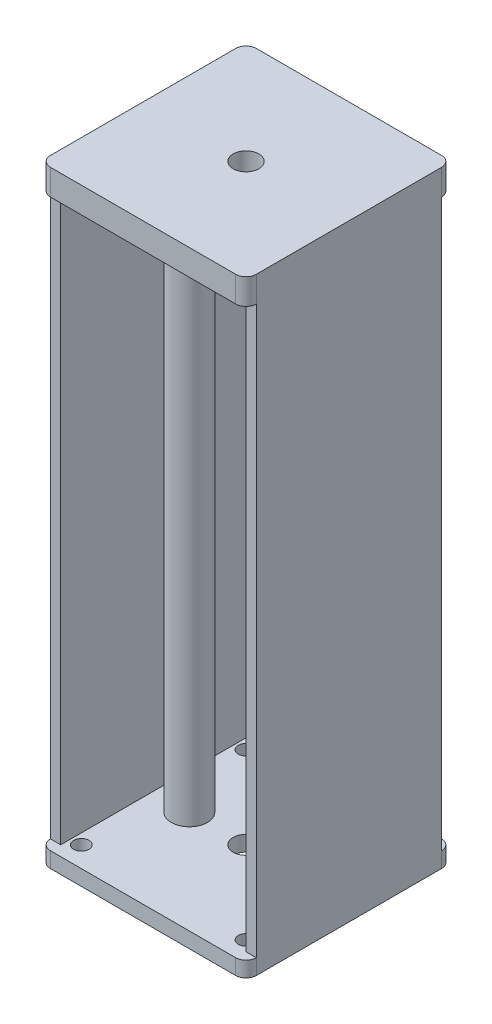
from build123d import *

# Parameters (mm, degrees)
SKETCH1_W           = 40
SKETCH1_H           = 40
BOSS_EXTRUDE1_DEPTH = 5
FILLET1_R           = 2
SKETCH2_W           = 2
SKETCH2_H           = 36
BOSS_EXTRUDE2_DEPTH = 110
SKETCH3_W           = 40
SKETCH3_H           = 40
BOSS_EXTRUDE3_DEPTH = 3
FILLET2_R           = 2
SKETCH4_R           = 1.5
CUT_EXTRUDE1_DEPTH  = 10
SKETCH5_R           = 2.5
CUT_EXTRUDE2_DEPTH  = 127.368508888
SKETCH6_R           = 2.5
CUT_EXTRUDE4_DEPTH  = 131.858702575
SKETCH8_R           = 3.5
BOSS_EXTRUDE4_DEPTH = 114


with BuildPart() as part:
    # Sketch1 → Boss-Extrude1 (new body)
    with BuildSketch(Plane(origin=(0, 0, 0), x_dir=(1, 0, 0), z_dir=(0, 1, 0))):
        with Locations((20, -20)):
            Rectangle(SKETCH1_W, SKETCH1_H)
    extrude(amount=BOSS_EXTRUDE1_DEPTH)

    # Fillet1
    fillet1_edges = [part.edges().sort_by_distance(p)[0] for p in [
        (40, 2.5, 0),
        (40, 2.5, 40),
        (0, 2.5, 40),
        (0, 2.5, 0),
    ]]
    fillet(fillet1_edges, radius=FILLET1_R)

    # Sketch2 → Boss-Extrude2 (add)
    with BuildSketch(Plane.XZ):
        with Locations((1, 20)):
            Rectangle(SKETCH2_W, SKETCH2_H)
        with Locations((39, 20)):
            Rectangle(SKETCH2_W, SKETCH2_H)
    extrude(amount=BOSS_EXTRUDE2_DEPTH)

    # Sketch3 → Boss-Extrude3 (add)
    with BuildSketch(Plane.XZ.offset(110)):
        with Locations((20, 20)):
            Rectangle(SKETCH3_W, SKETCH3_H)
    extrude(amount=BOSS_EXTRUDE3_DEPTH)

    # Fillet2
    fillet2_edges = [part.edges().sort_by_distance(p)[0] for p in [
        (0, -111.5, 0),
        (40, -111.5, 0),
        (40, -111.5, 40),
        (0, -111.5, 40),
    ]]
    fillet(fillet2_edges, radius=FILLET2_R)

    # Sketch4 → Cut-Extrude1 (cut)
    with BuildSketch(Plane.XZ.offset(113)):
        with Locations(Location((4, 4, 0), (0, 0, 270))):
            Circle(SKETCH4_R)
        with Locations(Location((36, 4, 0), (0, 0, 270))):
            Circle(SKETCH4_R)
        with Locations(Location((4, 36, 0), (0, 0, 270))):
            Circle(SKETCH4_R)
        with Locations(Location((36, 36, 0), (0, 0, 270))):
            Circle(SKETCH4_R)
    extrude(amount=-CUT_EXTRUDE1_DEPTH, mode=Mode.SUBTRACT)

    # Sketch5 → Cut-Extrude2 (cut, through all)
    with BuildSketch(Plane(origin=(0, 0, 0), x_dir=(1, 0, 0), z_dir=(0, 1, 0))):
        with Locations(Location((20, -20, 0), (0, 0, 270))):
            Circle(SKETCH5_R)
    extrude(amount=CUT_EXTRUDE2_DEPTH, mode=Mode.SUBTRACT)

    # Sketch6 → Cut-Extrude4 (cut, through all)
    with BuildSketch(Plane.XZ.offset(113)):
        with Locations(Location((20, 20, 0), (0, 0, 90))):
            Circle(SKETCH6_R)
    extrude(amount=-CUT_EXTRUDE4_DEPTH, mode=Mode.SUBTRACT)

    # Sketch8 → Boss-Extrude4 (add)
    with BuildSketch(Plane(origin=(0, -110, 0), x_dir=(1, 0, 0), z_dir=(0, 1, 0))):
        with Locations(Location((9, -20, 0), (0, 0, 270))):
            Circle(SKETCH8_R)
        with Locations(Location((31, -20, 0), (0, 0, 270))):
            Circle(SKETCH8_R)
    extrude(amount=BOSS_EXTRUDE4_DEPTH)


solid = part.part
